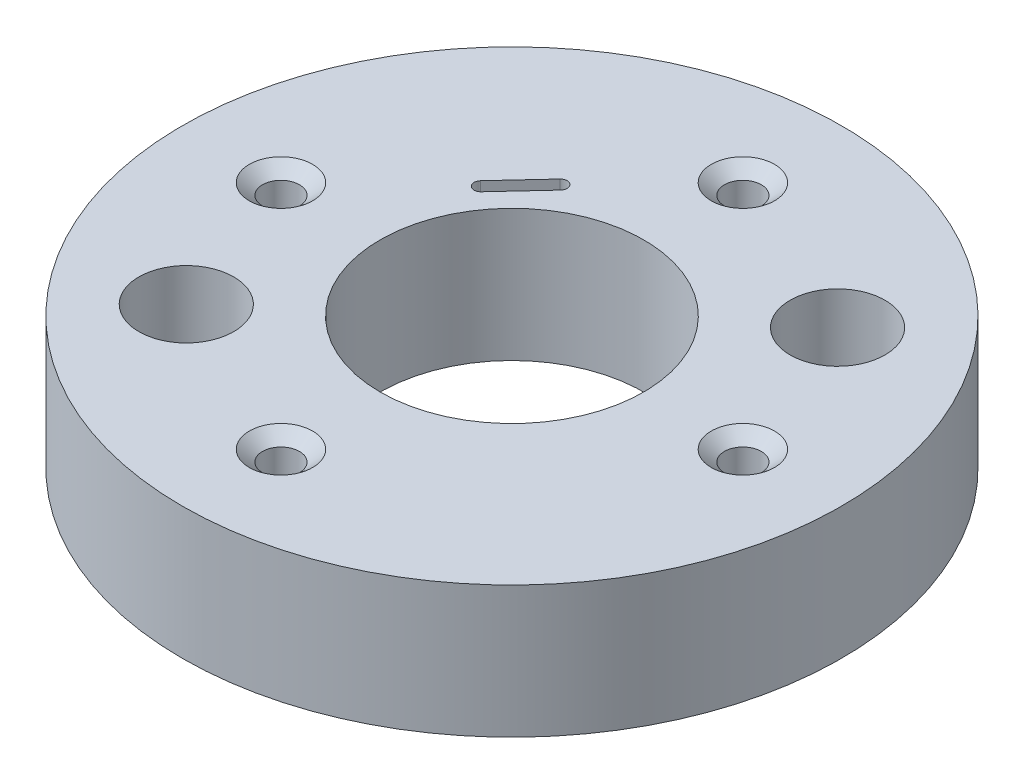
from build123d import *

# Parameters (mm, degrees)
SKETCH1_R                           = 15.875
BOSS_EXTRUDE1_DEPTH                 = 6.35
SKETCH2_R                           = 6.35
CUT_EXTRUDE1_DEPTH                  = 24.3313898
TAP_DRILL_FOR_2_56_TAP2_D           = 1.778
TAP_DRILL_FOR_2_56_TAP2_CSINK_D     = 3.048
TAP_DRILL_FOR_2_56_TAP2_CSINK_ANGLE = 100
CIRPATTERN1_COUNT                   = 2
CIRPATTERN2_COUNT                   = 2
SKETCH11_R                          = 2.286
CUT_EXTRUDE2_DEPTH                  = 24.3313898
CIRPATTERN3_COUNT                   = 2
CUT_EXTRUDE3_DEPTH                  = 24.3313898


with BuildPart() as part:
    # Sketch1 → Boss-Extrude1 (new body)
    with BuildSketch(Plane(origin=(0, 0, 0), x_dir=(1, 0, 0), z_dir=(0, 1, 0))):
        with Locations(Location((0, 0, 0), (0, 0, 270))):
            Circle(SKETCH1_R)
    extrude(amount=BOSS_EXTRUDE1_DEPTH)

    # Sketch2 → Cut-Extrude1 (cut, through all)
    with BuildSketch(Plane(origin=(0, 6.35, 0), x_dir=(1, 0, 0), z_dir=(0, 1, 0))):
        with Locations(Location((0, 0, 0), (0, 0, 270))):
            Circle(SKETCH2_R)
    extrude(amount=-CUT_EXTRUDE1_DEPTH, mode=Mode.SUBTRACT)

    # Tap Drill for #2-56 Tap2 (through all)
    with Locations(Plane(origin=(0, 6.35, 0), x_dir=(1, 0, 0), z_dir=(0, 1, 0))):
        with Locations((0, 11.1252)):
            tap_drill_for_2_56_tap2 = CounterSinkHole(TAP_DRILL_FOR_2_56_TAP2_D / 2, TAP_DRILL_FOR_2_56_TAP2_CSINK_D / 2, counter_sink_angle=TAP_DRILL_FOR_2_56_TAP2_CSINK_ANGLE)

    # CirPattern1: Tap Drill for #2-56 Tap2 ×2 about axis
    cirpattern1_axis = Axis((0, 0, 0), (0, 1, 0))
    for i in range(1, CIRPATTERN1_COUNT):
        add(tap_drill_for_2_56_tap2.rotate(cirpattern1_axis, i * 360 / CIRPATTERN1_COUNT), mode=Mode.SUBTRACT)

    # Sketch10 → Tap Drill for #2-56 Tap1 (revolve, cut)
    with BuildSketch(Plane(origin=(11.1252, 6.35, 0), x_dir=(0, 0, 1), z_dir=(1, 0, 0))):
        Polygon((0, 0), (0, 4.34416509), (0.889, 3.81), (0.889, 0.532828266), (1.524, 0), align=None)
    tap_drill_for_2_56_tap1 = revolve(axis=Axis((11.1252, 12.7, 0), (0, -1, 0)), mode=Mode.SUBTRACT)

    # CirPattern2: Tap Drill for #2-56 Tap1 ×2 about axis
    cirpattern2_axis = Axis((0, 0, 0), (0, 1, 0))
    for i in range(1, CIRPATTERN2_COUNT):
        add(tap_drill_for_2_56_tap1.rotate(cirpattern2_axis, i * 360 / CIRPATTERN2_COUNT), mode=Mode.SUBTRACT)

    # Sketch11 → Cut-Extrude2 (cut, through all)
    with BuildSketch(Plane(origin=(0, 6.35, 0), x_dir=(1, 0, 0), z_dir=(0, 1, 0))):
        with Locations(Location((8.328911597, 7.35641814, 0), (0, 0, 270))):
            Circle(SKETCH11_R)
    cut_extrude2 = extrude(amount=-CUT_EXTRUDE2_DEPTH, mode=Mode.SUBTRACT)

    # CirPattern3: Cut-Extrude2 ×2 about axis
    cirpattern3_axis = Axis((0, 0, 0), (0, 1, 0))
    for i in range(1, CIRPATTERN3_COUNT):
        add(cut_extrude2.rotate(cirpattern3_axis, i * 360 / CIRPATTERN3_COUNT), mode=Mode.SUBTRACT)

    # Sketch12 → Cut-Extrude3 (cut, through all)
    with BuildSketch(Plane(origin=(0, 6.35, 0), x_dir=(1, 0, 0), z_dir=(0, 1, 0))):
        with BuildLine():
            Line((-6.39758264, 4.883452605), (-4.554151289, 6.87011727))
            ThreePointArc((-4.554151289, 6.87011727), (-4.0916663, 6.887412726), (-4.074370844, 6.424927737))
            Line((-4.074370844, 6.424927737), (-5.917802195, 4.438263073))
            ThreePointArc((-5.917802195, 4.438263073), (-6.380287183, 4.420967617), (-6.39758264, 4.883452605))
        make_face()
    extrude(amount=-CUT_EXTRUDE3_DEPTH, mode=Mode.SUBTRACT)


solid = part.part
